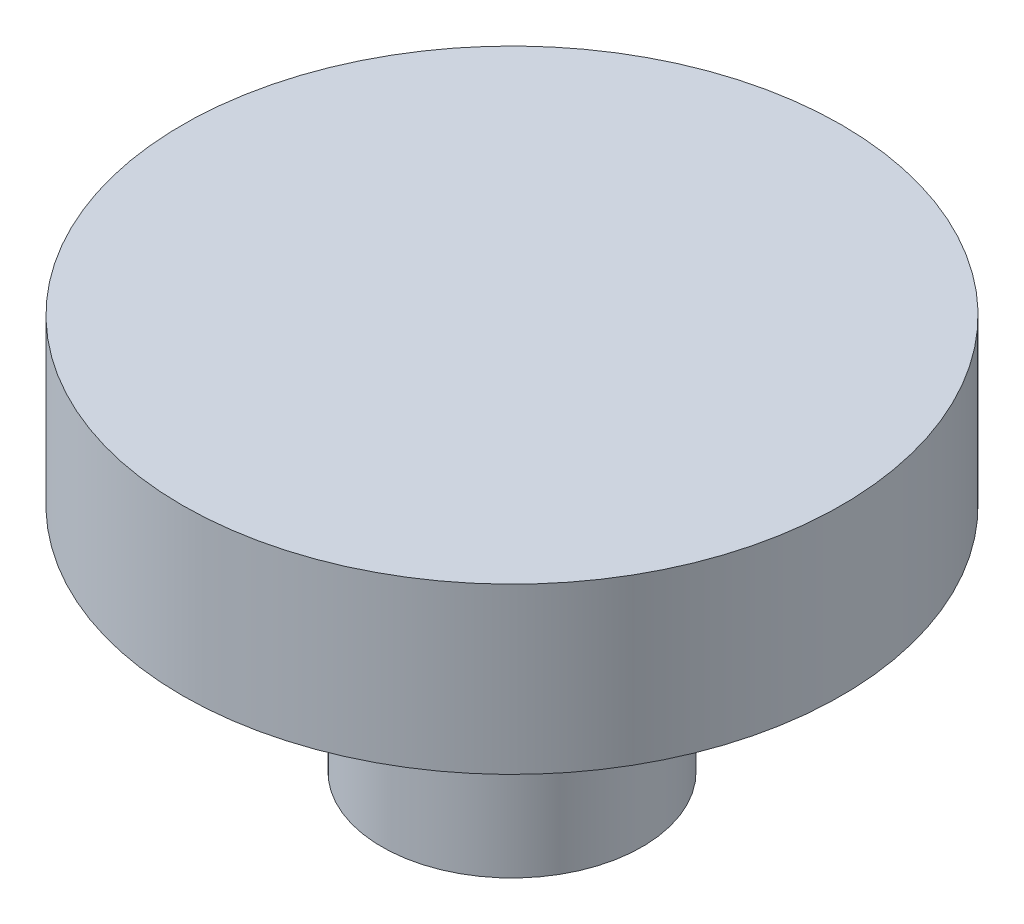
from build123d import *

# Parameters (mm, degrees)
SKETCH1_R           = 10
BOSS_EXTRUDE1_DEPTH = 5
SKETCH2_R           = 3.95
BOSS_EXTRUDE2_DEPTH = 7


with BuildPart() as part:
    # Sketch1 → Boss-Extrude1 (new body)
    with BuildSketch(Plane(origin=(-645.719089615, 0, 411.175989112), x_dir=(-0.4230025267803184, 0, 0.9061285021107469), z_dir=(0, -1, 0))):
        with Locations(Location((52.987730107, -483.544948633, 0), (0, 0, 154.975704785))):
            Circle(SKETCH1_R)
    extrude(amount=BOSS_EXTRUDE1_DEPTH)

    # Sketch2 → Boss-Extrude2 (add)
    with BuildSketch(Plane(origin=(0, -5, 0), x_dir=(-0.4230025267803189, 0, 0.9061285021107468), z_dir=(0, -1, 0))):
        with Locations(Location((698.706819722, -72.368959522, 0), (0, 0, 154.975704785))):
            Circle(SKETCH2_R)
    extrude(amount=BOSS_EXTRUDE2_DEPTH)


solid = part.part
